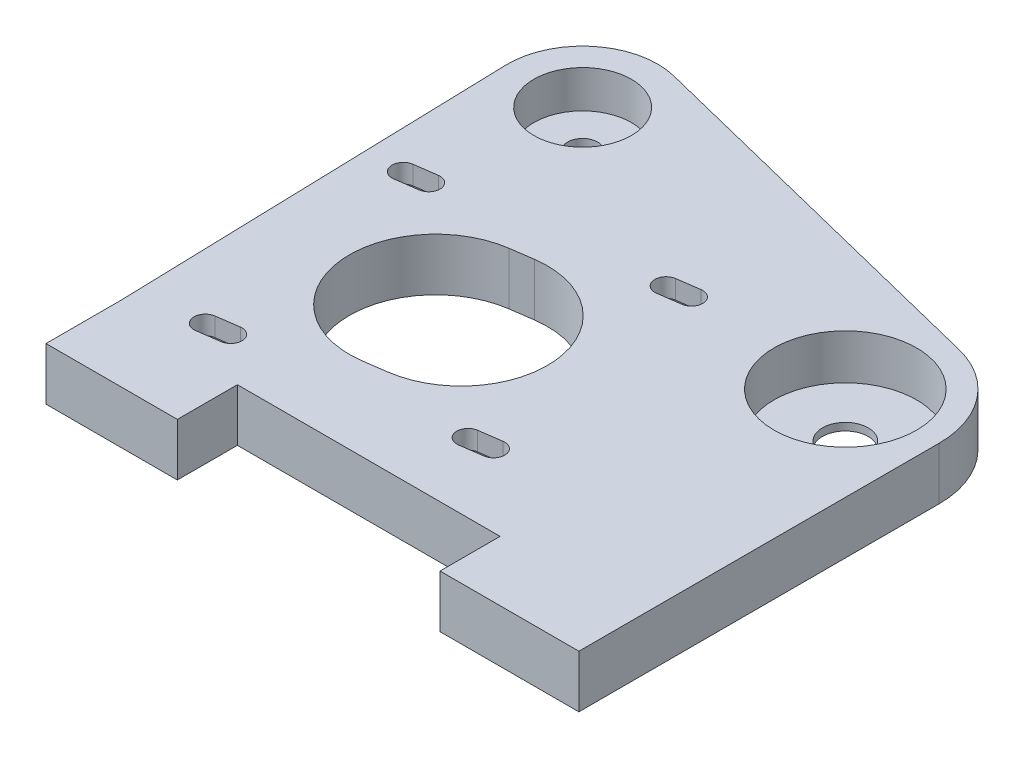
from build123d import *

# Parameters (mm, degrees)
SKETCH2_R           = 3.05
SKETCH2_R_2         = 2
BOSS_EXTRUDE1_DEPTH = 7
CUT_EXTRUDE1_START  = 7
SKETCH2_4_R         = 9.5
CUT_EXTRUDE1_DEPTH  = 6
CUT_EXTRUDE2_START  = 7
SKETCH2_5_R         = 6.5
CUT_EXTRUDE2_DEPTH  = 5
CUT_EXTRUDE3_DEPTH  = 4.5


with BuildPart() as part:
    # Sketch2 → Boss-Extrude1 (new body)
    with BuildSketch(Plane(origin=(0, 0, 0), x_dir=(1, 0, 0), z_dir=(0, 1, 0))):
        with BuildLine():
            Line((102.512048312, 24.992099408), (102.512048312, -23.007900592))
            Line((102.512048312, -23.007900592), (84.012048312, -23.007900592))
            Line((84.012048312, -23.007900592), (84.012048312, -15.007900592))
            Line((84.012048312, -15.007900592), (49.012048312, -15.007900592))
            Line((49.012048312, -15.007900592), (49.012048312, -23.007900592))
            Line((49.012048312, -23.007900592), (31.512048312, -23.007900592))
            Line((31.512048312, -23.007900592), (31.512048312, -13.007900592))
            Line((31.512048312, -13.007900592), (30.016072392, 39.708435169))
            ThreePointArc((30.016072392, 39.708435169), (33.741164308, 47.78158038), (42.423514406, 49.696986387))
            Line((42.423514406, 49.696986387), (93.026380929, 37.123208132))
            ThreePointArc((93.026380929, 37.123208132), (99.859107713, 32.691802074), (102.512048312, 24.992099408))
        make_face()
        with Locations(Location((90.012048312, 24.992099408, 0), (0, 0, 270))):
            Circle(SKETCH2_R, mode=Mode.SUBTRACT)
        with Locations(Location((40.012048312, 39.992099408, 0), (0, 0, 270))):
            Circle(SKETCH2_R_2, mode=Mode.SUBTRACT)
        with BuildLine():
            Line((51.378851017, 18.833843692), (54.349655223, 19.251362995))
            ThreePointArc((54.349655223, 19.251362995), (67.338228674, 9.463770865), (57.550636545, -3.524802586))
            Line((57.550636545, -3.524802586), (54.579832339, -3.942321889))
            ThreePointArc((54.579832339, -3.942321889), (41.591258887, 5.84527024), (51.378851017, 18.833843692))
        make_face(mode=Mode.SUBTRACT)
        with BuildLine():
            Line((65.962554027, 26.437501135), (68.933358233, 26.855020438))
            ThreePointArc((68.933358233, 26.855020438), (70.627519988, 25.578377986), (69.350877536, 23.884216232))
            Line((69.350877536, 23.884216232), (66.38007333, 23.466696929))
            ThreePointArc((66.38007333, 23.466696929), (64.685911575, 24.74333938), (65.962554027, 26.437501135))
        make_face(mode=Mode.SUBTRACT)
        with BuildLine():
            Line((70.694439459, -7.231613202), (73.665243666, -6.814093899))
            ThreePointArc((73.665243666, -6.814093899), (74.941886117, -5.119932145), (73.247724363, -3.843289693))
            Line((73.247724363, -3.843289693), (70.276920157, -4.260808996))
            ThreePointArc((70.276920157, -4.260808996), (69.000277705, -5.954970751), (70.694439459, -7.231613202))
        make_face(mode=Mode.SUBTRACT)
        with BuildLine():
            Line((42.966933535, -11.128460029), (39.996129329, -11.545979332))
            ThreePointArc((39.996129329, -11.545979332), (38.301967574, -10.26933688), (39.578610026, -8.575175126))
            Line((39.578610026, -8.575175126), (42.549414232, -8.157655823))
            ThreePointArc((42.549414232, -8.157655823), (44.243575986, -9.434298275), (42.966933535, -11.128460029))
        make_face(mode=Mode.SUBTRACT)
        with BuildLine():
            Line((38.235048102, 22.540654308), (35.264243896, 22.123135005))
            ThreePointArc((35.264243896, 22.123135005), (33.987601444, 20.428973251), (35.681763199, 19.152330799))
            Line((35.681763199, 19.152330799), (38.652567405, 19.569850102))
            ThreePointArc((38.652567405, 19.569850102), (39.929209857, 21.264011856), (38.235048102, 22.540654308))
        make_face(mode=Mode.SUBTRACT)
    extrude(amount=BOSS_EXTRUDE1_DEPTH)

    # Sketch2<4> → Cut-Extrude1 (cut)
    with BuildSketch(Plane(origin=(0, 0, 0), x_dir=(1, 0, 0), z_dir=(0, 1, 0)).offset(CUT_EXTRUDE1_START)):
        with Locations(Location((90.012048312, 24.992099408, 0), (0, 0, 270))):
            Circle(SKETCH2_4_R)
    extrude(amount=-CUT_EXTRUDE1_DEPTH, mode=Mode.SUBTRACT)

    # Sketch2<5> → Cut-Extrude2 (cut)
    with BuildSketch(Plane(origin=(0, 0, 0), x_dir=(1, 0, 0), z_dir=(0, 1, 0)).offset(CUT_EXTRUDE2_START)):
        with Locations(Location((40.012048312, 39.992099408, 0), (0, 0, 270))):
            Circle(SKETCH2_5_R)
    extrude(amount=-CUT_EXTRUDE2_DEPTH, mode=Mode.SUBTRACT)

    # Sketch2<6> → Cut-Extrude3 (cut)
    with BuildSketch(Plane(origin=(0, 0, 0), x_dir=(1, 0, 0), z_dir=(0, 1, 0))):
        with BuildLine():
            Line((65.788587651, 27.675336221), (68.759391857, 28.092855524))
            ThreePointArc((68.759391857, 28.092855524), (71.865355074, 25.752344362), (69.524843912, 22.646381146))
            Line((69.524843912, 22.646381146), (66.554039706, 22.228861843))
            ThreePointArc((66.554039706, 22.228861843), (63.448076489, 24.569373004), (65.788587651, 27.675336221))
        make_face()
        with BuildLine():
            Line((70.868405836, -8.469448288), (73.839210042, -8.051928985))
            ThreePointArc((73.839210042, -8.051928985), (76.179721203, -4.945965769), (73.073757987, -2.605454607))
            Line((73.073757987, -2.605454607), (70.10295378, -3.02297391))
            ThreePointArc((70.10295378, -3.02297391), (67.762442619, -6.128937127), (70.868405836, -8.469448288))
        make_face()
        with BuildLine():
            Line((38.061081726, 23.778489394), (35.09027752, 23.360970091))
            ThreePointArc((35.09027752, 23.360970091), (32.749766358, 20.255006874), (35.855729575, 17.914495713))
            Line((35.855729575, 17.914495713), (38.826533781, 18.332015016))
            ThreePointArc((38.826533781, 18.332015016), (41.167044943, 21.437978232), (38.061081726, 23.778489394))
        make_face()
        with BuildLine():
            Line((42.375447856, -6.919820737), (39.404643649, -7.33734004))
            ThreePointArc((39.404643649, -7.33734004), (37.064132488, -10.443303257), (40.170095705, -12.783814418))
            Line((40.170095705, -12.783814418), (43.140899911, -12.366295115))
            ThreePointArc((43.140899911, -12.366295115), (45.481411072, -9.260331898), (42.375447856, -6.919820737))
        make_face()
    extrude(amount=CUT_EXTRUDE3_DEPTH, mode=Mode.SUBTRACT)


solid = part.part
